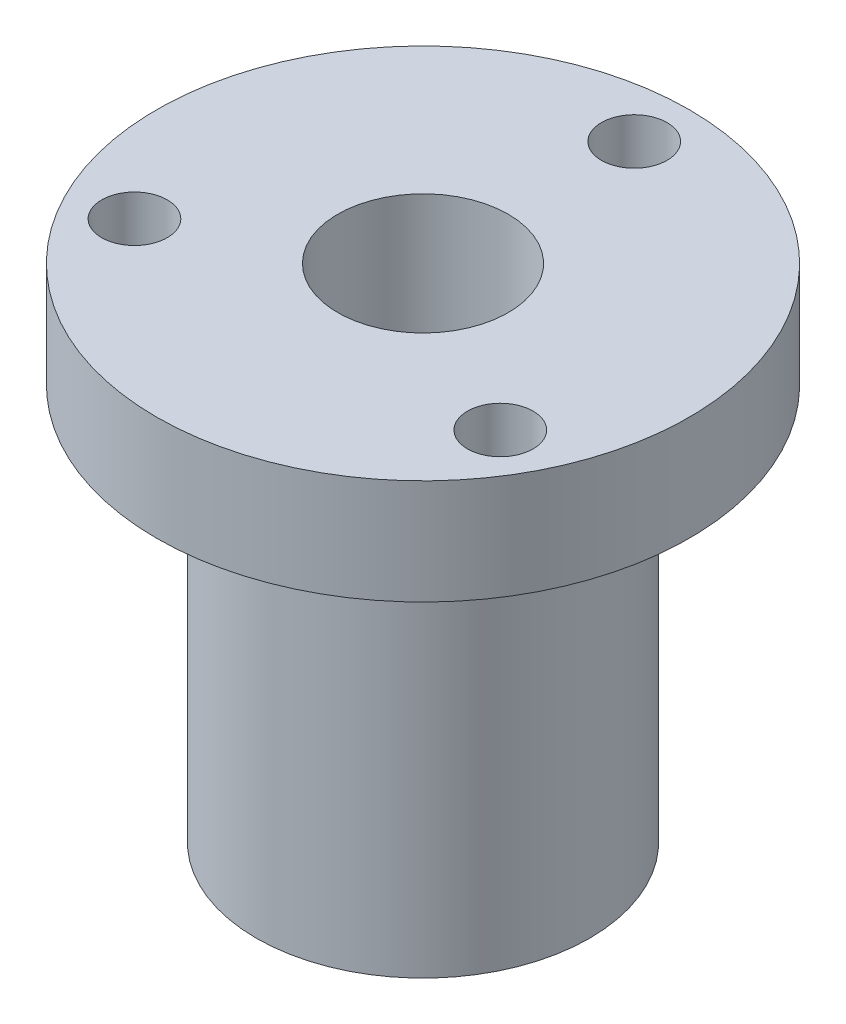
from build123d import *

# Parameters (mm, degrees)
CORTAR_EXTRUIR1_REACH     = 25.893
CROQUIS2_R                = 1.25
TALADRO_ROSCADO_M31_D     = 2.5
TALADRO_ROSCADO_M31_DEPTH = 8.5
TALADRO_ROSCADO_M31_TIP   = 0.751075774


with BuildPart() as part:
    # Croquis1 → Revolución1 (revolve)
    with BuildSketch(Plane.XY, mode=Mode.PRIVATE) as revoluci_n1_sk:
        Polygon((6.35, 0), (6.35, 15.1), (10.15, 15.1), (10.15, 19.1), (3.25, 19.1), (3.25, 0), align=None)
    revolve(revoluci_n1_sk.sketch.rotate(Axis((0, 0, 0), (0, 1, 0)), 90), axis=Axis((0, 0, 0), (0, 1, 0)))

    # Croquis2 → Cortar-Extruir1 (cut, up to next)
    with BuildSketch(Plane(origin=(0, 19.1, 0), x_dir=(1, 0, 0), z_dir=(0, 1, 0)), mode=Mode.PRIVATE) as cortar_extruir1_sk1:
        with Locations(Location((6.9715045, -4.025, 0), (0, 0, 270))):
            Circle(CROQUIS2_R)
    cortar_extruir1_tool1 = extrude(cortar_extruir1_sk1.sketch, amount=-CORTAR_EXTRUIR1_REACH, mode=Mode.PRIVATE) & part.part
    # Croquis2 → Cortar-Extruir1 (cut, up to next)
    with BuildSketch(Plane(origin=(0, 19.1, 0), x_dir=(1, 0, 0), z_dir=(0, 1, 0)), mode=Mode.PRIVATE) as cortar_extruir1_sk2:
        with Locations(Location((0, 8.05, 0), (0, 0, 270))):
            Circle(CROQUIS2_R)
    cortar_extruir1_tool2 = extrude(cortar_extruir1_sk2.sketch, amount=-CORTAR_EXTRUIR1_REACH, mode=Mode.PRIVATE) & part.part
    # Croquis2 → Cortar-Extruir1 (cut, up to next)
    with BuildSketch(Plane(origin=(0, 19.1, 0), x_dir=(1, 0, 0), z_dir=(0, 1, 0)), mode=Mode.PRIVATE) as cortar_extruir1_sk3:
        with Locations(Location((-6.9715045, -4.025, 0), (0, 0, 270))):
            Circle(CROQUIS2_R)
    cortar_extruir1_tool3 = extrude(cortar_extruir1_sk3.sketch, amount=-CORTAR_EXTRUIR1_REACH, mode=Mode.PRIVATE) & part.part
    add(cortar_extruir1_tool1.solids().sort_by_distance((6.971505, 19.1, 4.025))[0], mode=Mode.SUBTRACT)
    add(cortar_extruir1_tool2.solids().sort_by_distance((0, 19.1, -8.05))[0], mode=Mode.SUBTRACT)
    add(cortar_extruir1_tool3.solids().sort_by_distance((-6.971505, 19.1, 4.025))[0], mode=Mode.SUBTRACT)

    # Taladro roscado M31
    with Locations(Plane(origin=(0, 15.1, -8.05), x_dir=(0, 0, -1), z_dir=(0, -1, 0))):
        with Locations((0, 0), (-12.075, 6.9715045), (-12.075, -6.9715045)):
            Hole(TALADRO_ROSCADO_M31_D / 2, depth=TALADRO_ROSCADO_M31_DEPTH)
            with Locations((0, 0, -(TALADRO_ROSCADO_M31_DEPTH + TALADRO_ROSCADO_M31_TIP / 2))):  # 118° drill point
                Cone(0, TALADRO_ROSCADO_M31_D / 2, TALADRO_ROSCADO_M31_TIP, mode=Mode.SUBTRACT)


solid = part.part
